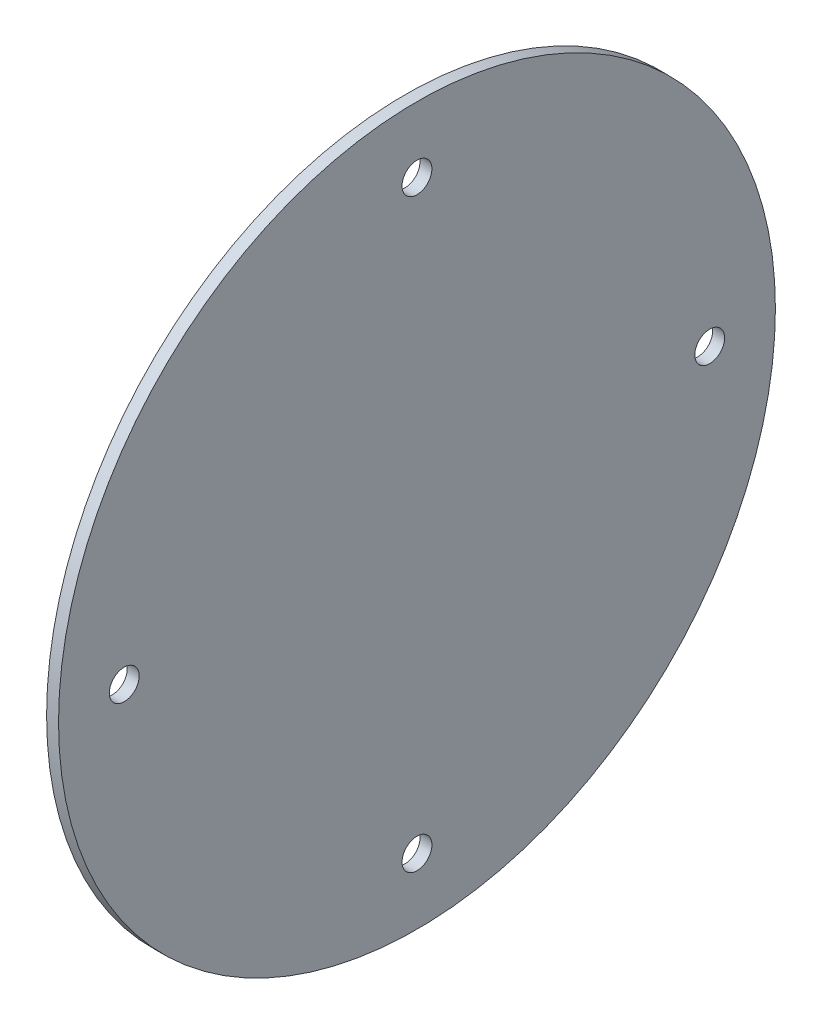
from build123d import *

# Parameters (mm, degrees)
SKETCH1_R           = 76.2
BOSS_EXTRUDE1_DEPTH = 2.54
SKETCH2_R           = 3.175
CUT_EXTRUDE2_DEPTH  = 108.793003484
CIRPATTERN2_COUNT   = 4


with BuildPart() as part:
    # Sketch1 → Boss-Extrude1 (new body)
    with BuildSketch(Plane.YZ):
        with Locations(Location((0, 0, 0), (0, 0, 270))):
            Circle(SKETCH1_R)
    extrude(amount=BOSS_EXTRUDE1_DEPTH)

    # Sketch2 → Cut-Extrude2 (cut, through all)
    with BuildSketch(Plane(origin=(2.54, 0, 0), x_dir=(0, 0, -1), z_dir=(1, 0, 0))):
        with Locations((-62.23, 0)):
            Circle(SKETCH2_R)
    cut_extrude2 = extrude(amount=-CUT_EXTRUDE2_DEPTH, mode=Mode.SUBTRACT)

    # CirPattern2: Cut-Extrude2 ×4 about axis
    cirpattern2_axis = Axis((0, 0, 0), (1, 0, 0))
    for i in range(1, CIRPATTERN2_COUNT):
        add(cut_extrude2.rotate(cirpattern2_axis, i * 360 / CIRPATTERN2_COUNT), mode=Mode.SUBTRACT)


solid = part.part
